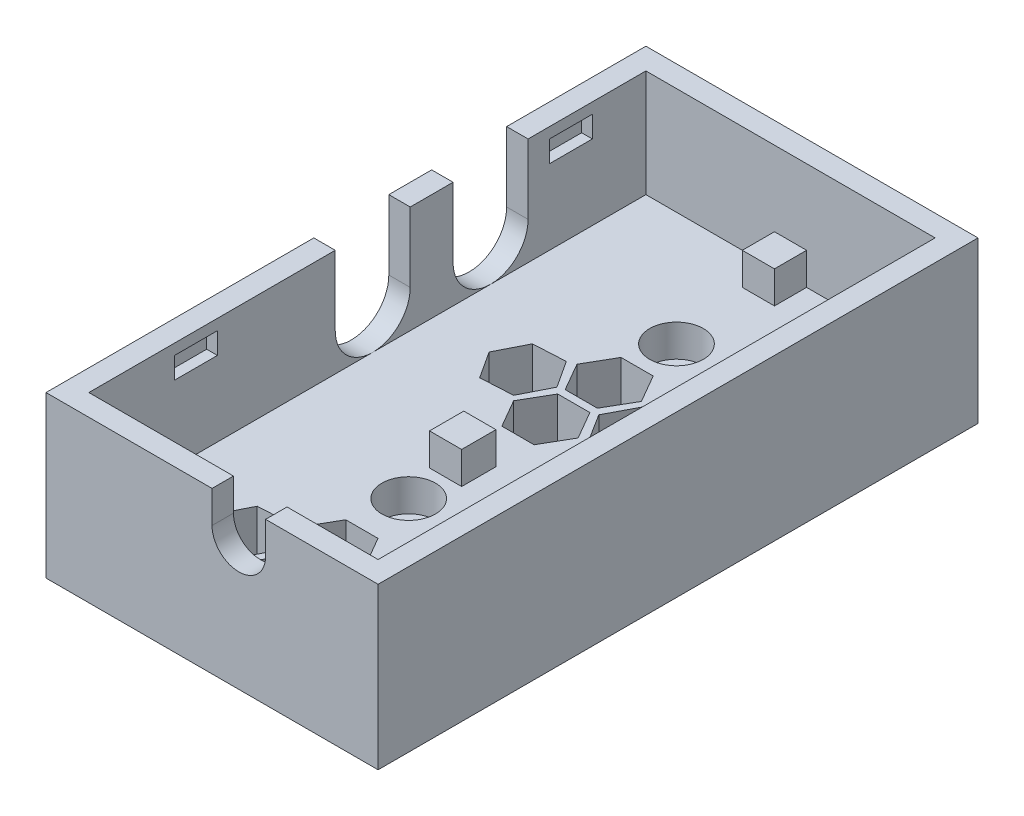
from build123d import *

# Parameters (mm, degrees)
ESQUISSE1_W             = 31
ESQUISSE1_H             = 56
BOSS_EXTRU_1_DEPTH      = 5
ESQUISSE2_R             = 1.3
ENL_V_MAT_EXTRU_1_DEPTH = 65.202803677
ESQUISSE4_R             = 2.5
ENL_V_MAT_EXTRU_2_DEPTH = 3
ESQUISSE5_W             = 3
ESQUISSE5_H             = 3
ESQUISSE5_H_2           = 3.199702253
BOSS_EXTRU_2_DEPTH      = 3
ESQUISSE6_W             = 31
ESQUISSE6_H             = 56
ESQUISSE6_W_2           = 27
ESQUISSE6_H_2           = 52
BOSS_EXTRU_3_DEPTH      = 10
ENL_V_MAT_EXTRU_3_DEPTH = 10
ENL_V_MAT_EXTRU_4_DEPTH = 10
ESQUISSE10_W            = 4
ESQUISSE10_H            = 2
ENL_V_MAT_EXTRU_5_DEPTH = 1
ESQUISSE11_W            = 4
ESQUISSE11_H            = 2
ENL_V_MAT_EXTRU_6_DEPTH = 1


with BuildPart() as part:
    # Esquisse1 → Boss.-Extru.1 (new body)
    with BuildSketch(Plane(origin=(0, 0, 0), x_dir=(1, 0, 0), z_dir=(0, 1, 0))):
        with Locations((15.5, 28)):
            Rectangle(ESQUISSE1_W, ESQUISSE1_H)
    extrude(amount=BOSS_EXTRU_1_DEPTH)

    # Esquisse2 → Enlèv. mat.-Extru.1 (cut, through all)
    with BuildSketch(Plane(origin=(0, 5, 0), x_dir=(1, 0, 0), z_dir=(0, 1, 0))):
        with Locations(Location((15.5, 43.356492458, 0), (0, 0, 270))):
            Circle(ESQUISSE2_R)
        with Locations(Location((15.5, 18.356492458, 0), (0, 0, 270))):
            Circle(ESQUISSE2_R)
        Polygon((13.411017957, 34.281896818), (11.768091764, 36.801158467), (8.764884081, 36.637973473), (7.40460259, 33.955526829), (9.047528783, 31.43626518), (12.050736466, 31.599450174), align=None)
        Polygon((18.507637899, 37.071867086), (17.003818949, 39.676557912), (13.996181051, 39.676557912), (12.492362101, 37.071867086), (13.996181051, 34.46717626), (17.003818949, 34.46717626), align=None)
        Polygon((18.507637899, 31.162485434), (17.003818949, 33.76717626), (13.996181051, 33.76717626), (12.492362101, 31.162485434), (13.996181051, 28.557794609), (17.003818949, 28.557794609), align=None)
        Polygon((23.612406723, 34.235887688), (22.008252208, 36.780013083), (19.002897728, 36.662837218), (17.601697764, 34.001535959), (19.205852279, 31.457410565), (22.211206759, 31.574586429), align=None)
        Polygon((13.692694357, 8.311332727), (12.049768165, 10.830594377), (9.046560481, 10.667409382), (7.68627899, 7.984962739), (9.329205183, 5.465701089), (12.332412866, 5.628886084), align=None)
        Polygon((18.789314299, 11.101302996), (17.28549535, 13.705993821), (14.277857451, 13.705993821), (12.774038501, 11.101302996), (14.277857451, 8.49661217), (17.28549535, 8.49661217), align=None)
        Polygon((18.789314299, 5.191921344), (17.28549535, 7.79661217), (14.277857451, 7.79661217), (12.774038501, 5.191921344), (14.277857451, 2.587230518), (17.28549535, 2.587230518), align=None)
        Polygon((23.894083123, 8.265323598), (22.289928608, 10.809448992), (19.284574129, 10.692273128), (17.883374164, 8.030971869), (19.487528679, 5.486846474), (22.492883159, 5.604022339), align=None)
    extrude(amount=-ENL_V_MAT_EXTRU_1_DEPTH, mode=Mode.SUBTRACT)

    # Esquisse4 → Enlèv. mat.-Extru.2 (cut)
    with BuildSketch(Plane(origin=(0, 5, 0), x_dir=(1, 0, 0), z_dir=(0, 1, 0))):
        with Locations(Location((15.5, 43.356492458, 0), (0, 0, 270))):
            Circle(ESQUISSE4_R)
        with Locations(Location((15.5, 18.356492458, 0), (0, 0, 270))):
            Circle(ESQUISSE4_R)
    extrude(amount=-ENL_V_MAT_EXTRU_2_DEPTH, mode=Mode.SUBTRACT)

    # Esquisse5 → Boss.-Extru.2 (add)
    with BuildSketch(Plane(origin=(0, 5, 0), x_dir=(1, 0, 0), z_dir=(0, 1, 0))):
        with Locations((15.5, 52.5)):
            Rectangle(ESQUISSE5_W, ESQUISSE5_H)
        with Locations((15.5, 23.400148874)):
            Rectangle(ESQUISSE5_W, ESQUISSE5_H_2)
    extrude(amount=BOSS_EXTRU_2_DEPTH)

    # Esquisse6 → Boss.-Extru.3 (add)
    with BuildSketch(Plane(origin=(0, 5, 0), x_dir=(1, 0, 0), z_dir=(0, 1, 0))):
        with Locations((15.5, 28)):
            Rectangle(ESQUISSE6_W, ESQUISSE6_H)
        with Locations((15.5, 28)):
            Rectangle(ESQUISSE6_W_2, ESQUISSE6_H_2, mode=Mode.SUBTRACT)
    extrude(amount=BOSS_EXTRU_3_DEPTH)

    # Esquisse8 → Enlèv. mat.-Extru.3 (cut)
    with BuildSketch(Plane.ZY):
        with BuildLine():
            Line((-43, 15), (-43, 8.5))
            ThreePointArc((-43, 8.5), (-39.5, 5), (-36, 8.5))
            Line((-36, 8.5), (-36, 15))
            Line((-36, 15), (-43, 15))
        make_face()
        with BuildLine():
            Line((-32, 15), (-32, 8.5))
            ThreePointArc((-32, 8.5), (-28.5, 5), (-25, 8.5))
            Line((-25, 8.5), (-25, 15))
            Line((-25, 15), (-32, 15))
        make_face()
    extrude(amount=-ENL_V_MAT_EXTRU_3_DEPTH, mode=Mode.SUBTRACT)

    # Esquisse9 → Enlèv. mat.-Extru.4 (cut)
    with BuildSketch(Plane.XY):
        with BuildLine():
            Line((15.5, 15), (15.5, 12))
            ThreePointArc((15.5, 12), (18, 9.5), (20.5, 12))
            Line((20.5, 12), (20.5, 15))
            Line((20.5, 15), (15.5, 15))
        make_face()
    extrude(amount=-ENL_V_MAT_EXTRU_4_DEPTH, mode=Mode.SUBTRACT)

    # Esquisse10 → Enlèv. mat.-Extru.5 (cut)
    with BuildSketch(Plane.ZY.offset(-29)):
        with Locations((-43, 13)):
            Rectangle(ESQUISSE10_W, ESQUISSE10_H)
        with Locations((-14, 13)):
            Rectangle(ESQUISSE10_W, ESQUISSE10_H)
    extrude(amount=-ENL_V_MAT_EXTRU_5_DEPTH, mode=Mode.SUBTRACT)

    # Esquisse11 → Enlèv. mat.-Extru.6 (cut)
    with BuildSketch(Plane(origin=(2, 0, 0), x_dir=(0, 0, -1), z_dir=(1, 0, 0))):
        with Locations((12, 13)):
            Rectangle(ESQUISSE11_W, ESQUISSE11_H)
        with Locations((47, 13)):
            Rectangle(ESQUISSE11_W, ESQUISSE11_H)
    extrude(amount=-ENL_V_MAT_EXTRU_6_DEPTH, mode=Mode.SUBTRACT)


solid = part.part
